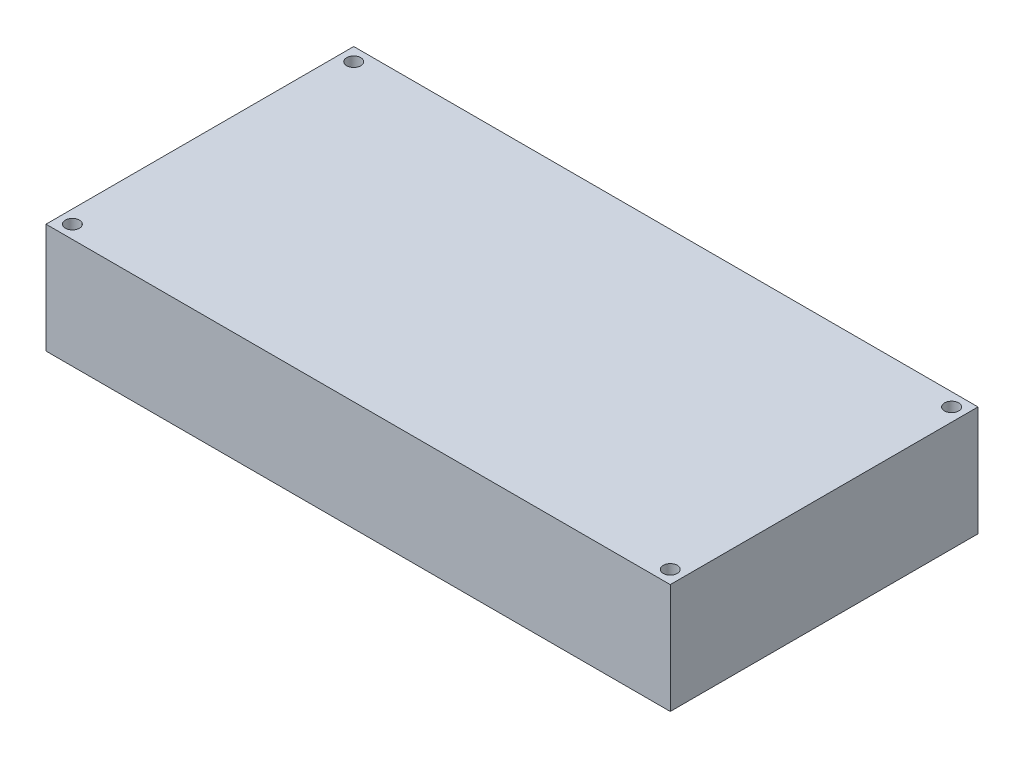
from build123d import *

# Parameters (mm, degrees)
SKETCH1_W           = 225.425
SKETCH1_H           = 111.125
SKETCH1_R           = 2.5527
BOSS_EXTRUDE1_DEPTH = 39.6875


with BuildPart() as part:
    # Sketch1 → Boss-Extrude1 (new body)
    with BuildSketch(Plane(origin=(0, 0, 0), x_dir=(1, 0, 0), z_dir=(0, 1, 0))):
        Rectangle(SKETCH1_W, SKETCH1_H)
        with Locations(Location((-107.95, 50.8, 0), (0, 0, 90))):
            Circle(SKETCH1_R, mode=Mode.SUBTRACT)
        with Locations(Location((107.95, 50.8, 0), (0, 0, 90))):
            Circle(SKETCH1_R, mode=Mode.SUBTRACT)
        with Locations(Location((107.95, -50.8, 0), (0, 0, 90))):
            Circle(SKETCH1_R, mode=Mode.SUBTRACT)
        with Locations(Location((-107.95, -50.8, 0), (0, 0, 90))):
            Circle(SKETCH1_R, mode=Mode.SUBTRACT)
    extrude(amount=BOSS_EXTRUDE1_DEPTH)


solid = part.part
